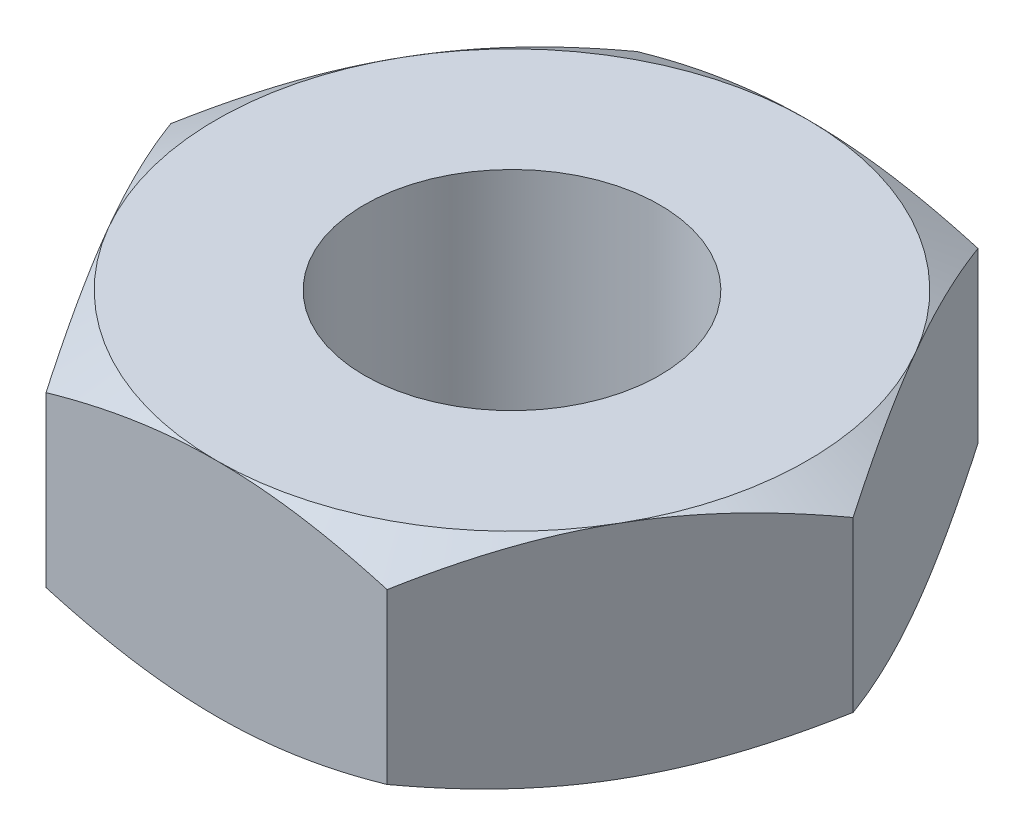
from build123d import *

# Parameters (mm, degrees)
SKETCH3_R               = 10
BOSS_EXTRUDE1_DEPTH     = 7.5
SKETCH4_OUTSIDE_W       = 67.7
SKETCH4_OUTSIDE_H       = 61.512
SKETCH4_OUTSIDE_R       = 20
CUT_EXTRUDE1_DEPTH      = 2
CUT_EXTRUDE1_DRAFT      = -60
MIRROR1_COPY_1_SKETCH_W = 67.7
MIRROR1_COPY_1_SKETCH_H = 61.512
MIRROR1_COPY_1_SKETCH_R = 20
MIRROR1_COPY_1_DEPTH    = 2
MIRROR1_COPY_1_DRAFT    = -60


with BuildPart() as part:
    # Sketch3 → Boss-Extrude1 (new, symmetric)
    with BuildSketch(Plane(origin=(0, 0, 0), x_dir=(1, 0, 0), z_dir=(0, 1, 0))):
        Polygon((23.094010768, 0), (11.547005384, 20), (-11.547005384, 20), (-23.094010768, 0), (-11.547005384, -20), (11.547005384, -20), align=None)
        with Locations(Location((0, 0, 0), (0, 0, 270))):
            Circle(SKETCH3_R, mode=Mode.SUBTRACT)
    extrude(amount=BOSS_EXTRUDE1_DEPTH, both=True)


with BuildPart() as cut_extrude1_tool:
    # Sketch4 outside → Cut-Extrude1 (with draft: the straight prism first)
    with BuildSketch(Plane.XZ.offset(7.5)):
        Rectangle(SKETCH4_OUTSIDE_W, SKETCH4_OUTSIDE_H)
        Circle(SKETCH4_OUTSIDE_R, mode=Mode.SUBTRACT)
    extrude(amount=-CUT_EXTRUDE1_DEPTH)
    # Cut-Extrude1: the draft: its side faces are tilted about the plane it starts from
    cut_extrude1_sides = [cut_extrude1_tool.faces().sort_by_distance(p)[0] for p in [
        (0, -6.5, -30.756),
        (33.85, -6.5, 0),
        (0, -6.5, 30.756),
        (-33.85, -6.5, 0),
        (-20, -6.5, 0),
    ]]
    draft(cut_extrude1_sides, Plane.XZ.offset(7.5), CUT_EXTRUDE1_DRAFT)


with BuildPart() as part_1:
    add(part.part)

    # Cut-Extrude1: cut by cut_extrude1_tool
    add(cut_extrude1_tool.part, mode=Mode.SUBTRACT)


with BuildPart() as mirror1_copy_1_tool:
    # Mirror1 copy 1 sketch → Mirror1 copy 1 (with draft: the straight prism first)
    with BuildSketch(Plane(origin=(0, 7.5, 0), x_dir=(1, 0, 0), z_dir=(0, 1, 0))):
        Rectangle(MIRROR1_COPY_1_SKETCH_W, MIRROR1_COPY_1_SKETCH_H)
        Circle(MIRROR1_COPY_1_SKETCH_R, mode=Mode.SUBTRACT)
    extrude(amount=-MIRROR1_COPY_1_DEPTH)
    # Mirror1 copy 1: the draft: its side faces are tilted about the plane it starts from
    mirror1_copy_1_sides = [mirror1_copy_1_tool.faces().sort_by_distance(p)[0] for p in [
        (0, 6.5, -30.756),
        (33.85, 6.5, 0),
        (0, 6.5, 30.756),
        (-33.85, 6.5, 0),
        (-20, 6.5, 0),
    ]]
    draft(mirror1_copy_1_sides, Plane(origin=(0, 7.5, 0), x_dir=(1, 0, 0), z_dir=(0, 1, 0)), MIRROR1_COPY_1_DRAFT)


with BuildPart() as part_2:
    add(part_1.part)

    # Mirror1 copy 1: cut by mirror1_copy_1_tool
    add(mirror1_copy_1_tool.part, mode=Mode.SUBTRACT)


solid = part_2.part
